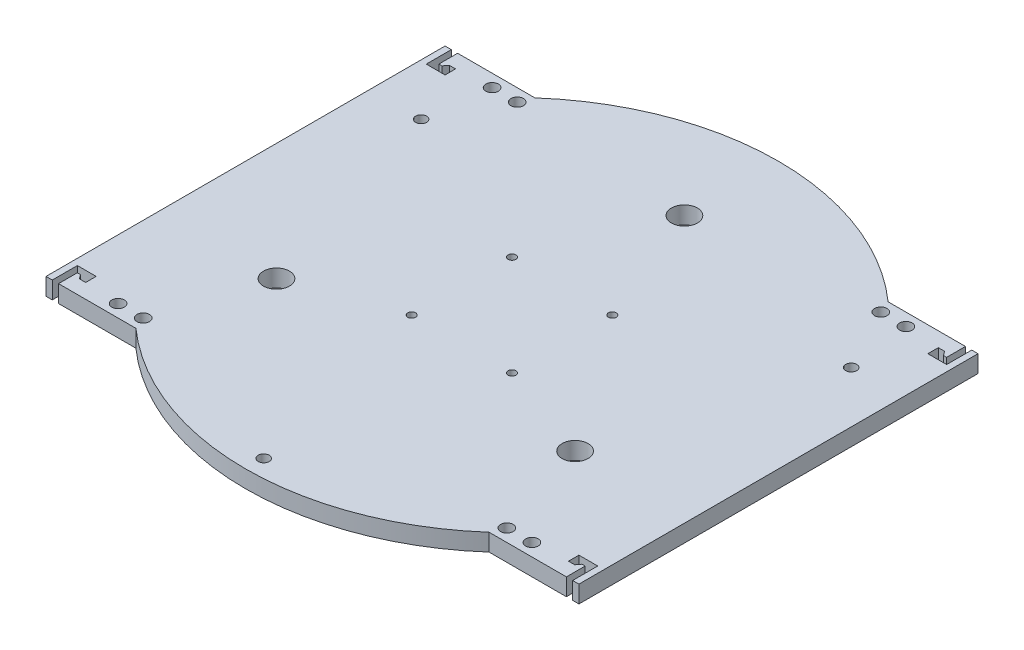
from build123d import *

# Parameters (mm, degrees)
SKETCH4_R           = 2
SKETCH4_R_2         = 1.25
SKETCH4_R_3         = 4.15
SKETCH4_R_4         = 1.75
BOSS_EXTRUDE1_DEPTH = 5.5


with BuildPart() as part:
    # Sketch4 → Boss-Extrude1 (new body)
    with BuildSketch(Plane(origin=(0, 0, 0), x_dir=(1, 0, 0), z_dir=(0, 1, 0))):
        with BuildLine():
            Line((56.335401836, 63.65), (81, 63.65))
            Line((81, 63.65), (81, 57.659411765))
            Line((81, 57.659411765), (80, 57.659411765))
            Line((80, 57.659411765), (79, 58.992745098))
            Line((79, 58.992745098), (77, 58.992745098))
            Line((77, 58.992745098), (77, 55.65))
            Line((77, 55.65), (83, 55.65))
            Line((83, 55.65), (83, 63.65))
            Line((83, 63.65), (85, 63.65))
            Line((85, 63.65), (85, -63.65))
            Line((85, -63.65), (83, -63.65))
            Line((83, -63.65), (83, -55.65))
            Line((83, -55.65), (77, -55.65))
            Line((77, -55.65), (77, -58.992745098))
            Line((77, -58.992745098), (79, -58.992745098))
            Line((79, -58.992745098), (80, -57.659411765))
            Line((80, -57.659411765), (81, -57.659411765))
            Line((81, -57.659411765), (81, -63.65))
            Line((81, -63.65), (56.335401836, -63.65))
            ThreePointArc((56.335401836, -63.65), (0, -85), (-56.335401836, -63.65))
            Line((-56.335401836, -63.65), (-81, -63.65))
            Line((-81, -63.65), (-81, -57.659411765))
            Line((-81, -57.659411765), (-80, -57.659411765))
            Line((-80, -57.659411765), (-79, -58.992745098))
            Line((-79, -58.992745098), (-77, -58.992745098))
            Line((-77, -58.992745098), (-77, -55.65))
            Line((-77, -55.65), (-83, -55.65))
            Line((-83, -55.65), (-83, -63.65))
            Line((-83, -63.65), (-85, -63.65))
            Line((-85, -63.65), (-85, 63.65))
            Line((-85, 63.65), (-83, 63.65))
            Line((-83, 63.65), (-83, 55.65))
            Line((-83, 55.65), (-77, 55.65))
            Line((-77, 55.65), (-77, 58.992745098))
            Line((-77, 58.992745098), (-79, 58.992745098))
            Line((-79, 58.992745098), (-80, 57.659411765))
            Line((-80, 57.659411765), (-81, 57.659411765))
            Line((-81, 57.659411765), (-81, 63.65))
            Line((-81, 63.65), (-56.335401836, 63.65))
            ThreePointArc((-56.335401836, 63.65), (0, 85), (56.335401836, 63.65))
        make_face()
        with Locations(Location((-58, 59.65, 0), (0, 0, 270))):
            Circle(SKETCH4_R, mode=Mode.SUBTRACT)
        with Locations(Location((-66, 59.65, 0), (0, 0, 270))):
            Circle(SKETCH4_R, mode=Mode.SUBTRACT)
        with Locations(Location((66, 59.65, 0), (0, 0, 90))):
            Circle(SKETCH4_R, mode=Mode.SUBTRACT)
        with Locations(Location((58, 59.65, 0), (0, 0, 90))):
            Circle(SKETCH4_R, mode=Mode.SUBTRACT)
        with Locations(Location((66, -59.65, 0), (0, 0, 270))):
            Circle(SKETCH4_R, mode=Mode.SUBTRACT)
        with Locations(Location((58, -59.65, 0), (0, 0, 270))):
            Circle(SKETCH4_R, mode=Mode.SUBTRACT)
        with Locations(Location((-58, -59.65, 0), (0, 0, 90))):
            Circle(SKETCH4_R, mode=Mode.SUBTRACT)
        with Locations(Location((-66, -59.65, 0), (0, 0, 90))):
            Circle(SKETCH4_R, mode=Mode.SUBTRACT)
        with Locations(Location((-16, 16, 0), (0, 0, 270))):
            Circle(SKETCH4_R_2, mode=Mode.SUBTRACT)
        with Locations(Location((16, 16, 0), (0, 0, 270))):
            Circle(SKETCH4_R_2, mode=Mode.SUBTRACT)
        with Locations(Location((16, -16, 0), (0, 0, 270))):
            Circle(SKETCH4_R_2, mode=Mode.SUBTRACT)
        with Locations(Location((-16, -16, 0), (0, 0, 270))):
            Circle(SKETCH4_R_2, mode=Mode.SUBTRACT)
        with Locations(Location((0, 55, 0), (0, 0, 270))):
            Circle(SKETCH4_R_3, mode=Mode.SUBTRACT)
        with Locations(Location((47.631397208, -27.5, 0), (0, 0, 270))):
            Circle(SKETCH4_R_3, mode=Mode.SUBTRACT)
        with Locations(Location((-47.631397208, -27.5, 0), (0, 0, 270))):
            Circle(SKETCH4_R_3, mode=Mode.SUBTRACT)
        with Locations(Location((0, -79.193683245, 0), (0, 0, 270))):
            Circle(SKETCH4_R_4, mode=Mode.SUBTRACT)
        with Locations(Location((-68.58374151, 39.596841623, 0), (0, 0, 270))):
            Circle(SKETCH4_R_4, mode=Mode.SUBTRACT)
        with Locations(Location((68.58374151, 39.596841623, 0), (0, 0, 270))):
            Circle(SKETCH4_R_4, mode=Mode.SUBTRACT)
    extrude(amount=BOSS_EXTRUDE1_DEPTH)


solid = part.part
